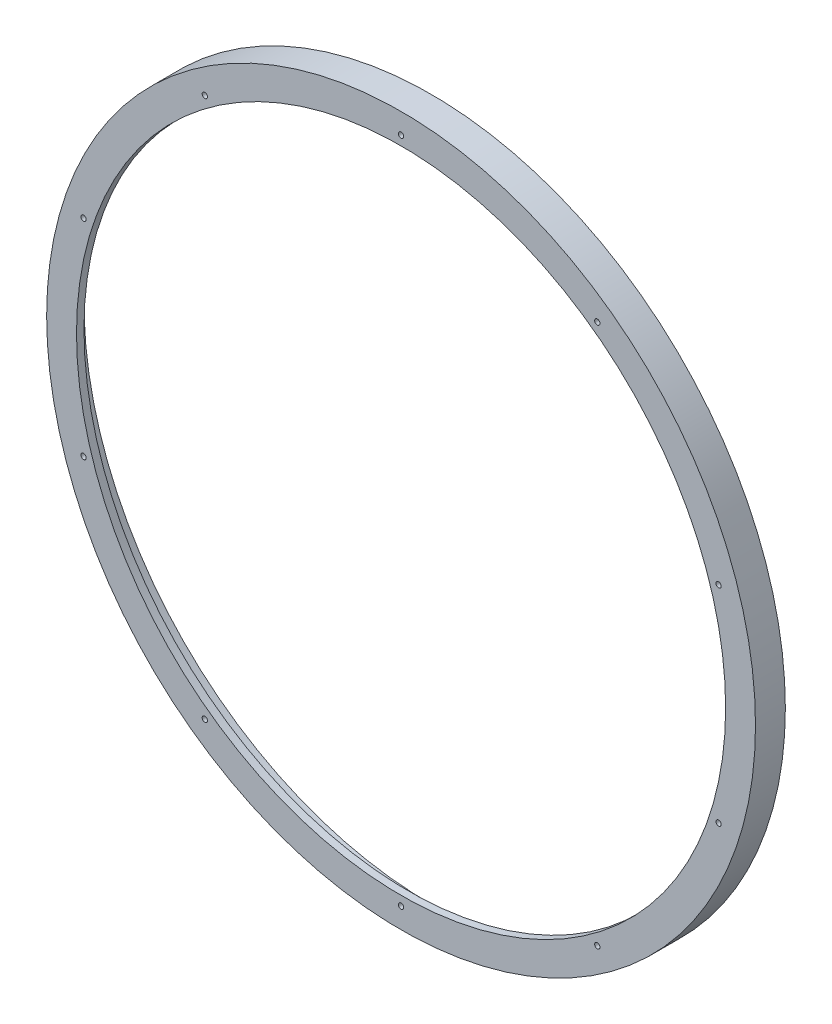
from build123d import *

# Parameters (mm, degrees)
F_4_40_TAPPED_HOLE1_D = 2.2606
CIRPATTERN1_COUNT     = 10


with BuildPart() as part:
    # Sketch1 → Revolve1 (revolve)
    with BuildSketch(Plane(origin=(0, 0, 0), x_dir=(0, 0, -1), z_dir=(1, 0, 0)), mode=Mode.PRIVATE) as revolve1_sk:
        Polygon((3.175, 147.574), (12.7, 147.574), (12.7, 150.749), (0, 150.749), (0, 138.049), (3.175, 138.049), align=None)
    revolve(revolve1_sk.sketch.rotate(Axis((0, 0, 0), (0, 0, -1)), 90), axis=Axis((0, 0, 0), (0, 0, -1)))

    # #4-40 Tapped Hole1 (through all)
    with Locations(Plane.XY):
        with Locations((0, 142)):
            f_4_40_tapped_hole1 = Hole(F_4_40_TAPPED_HOLE1_D / 2)

    # CirPattern1: #4-40 Tapped Hole1 ×10 about axis
    cirpattern1_axis = Axis((0, 0, 0), (0, 0, 1))
    for i in range(1, CIRPATTERN1_COUNT):
        add(f_4_40_tapped_hole1.rotate(cirpattern1_axis, i * 360 / CIRPATTERN1_COUNT), mode=Mode.SUBTRACT)


solid = part.part
